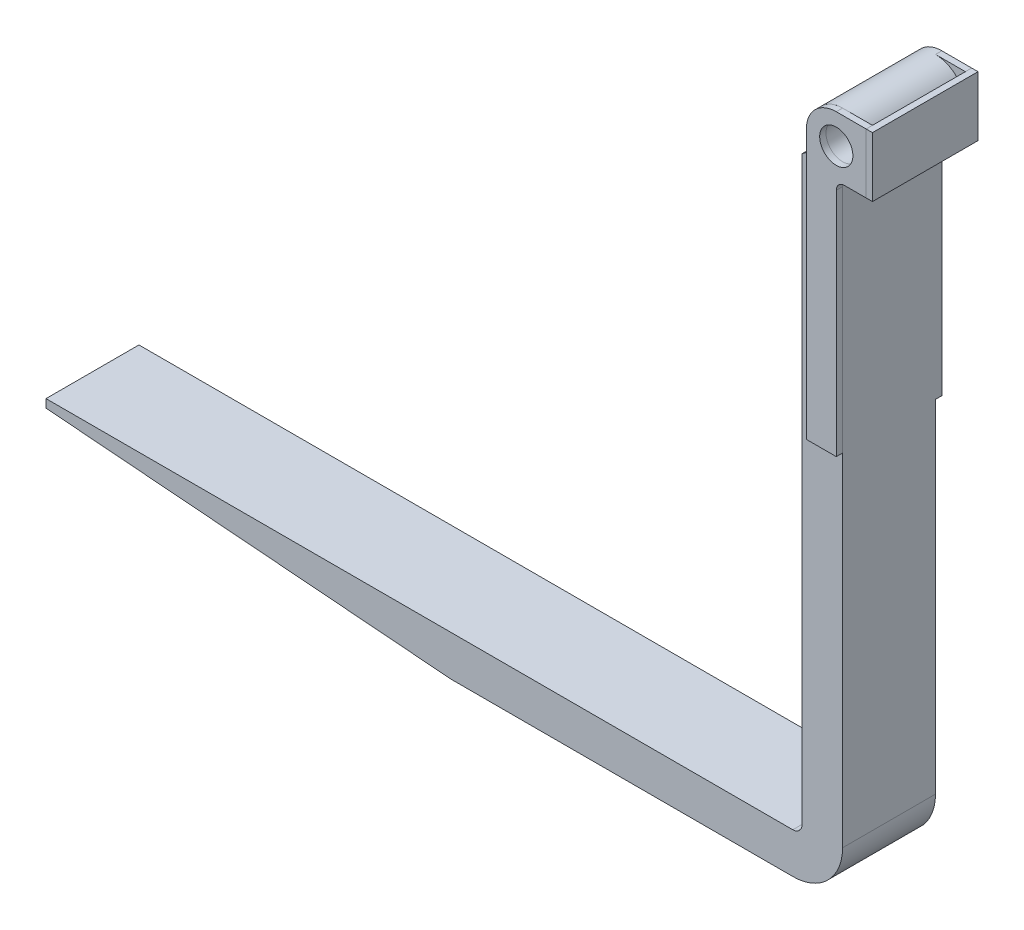
from build123d import *

# Parameters (mm, degrees)
EXTRUDE_THIN1_DEPTH     = 70
CUT_EXTRUDE1_DEPTH      = 1537.912489376
CUT_EXTRUDE1_DEPTH_BACK = 1537.912489376
SKETCH3_R               = 45
SKETCH3_R_2             = 25
BOSS_EXTRUDE1_DEPTH     = 70
BOSS_EXTRUDE2_DEPTH     = 70
SKETCH5_R               = 45
SKETCH5_R_2             = 25
BOSS_EXTRUDE3_DEPTH     = 9.5
SKETCH6_W               = 159
SKETCH6_H               = 90
BOSS_EXTRUDE4_DEPTH     = 9.5


with BuildPart() as part:
    # Sketch1 → Extrude-Thin1 (new, symmetric)
    with BuildSketch(Plane.XY):
        with BuildLine():
            Line((0, 950), (0, 75))
            ThreePointArc((0, 75), (-21.966991411, 21.966991411), (-75, 0))
            Line((-75, 0), (-1200, 0))
            Line((-1200, 0), (-1200, 61))
            Line((-1200, 61), (-75, 61))
            ThreePointArc((-75, 61), (-65.100505063, 65.100505063), (-61, 75))
            Line((-61, 75), (-61, 950))
            Line((-61, 950), (0, 950))
        make_face()
    extrude(amount=EXTRUDE_THIN1_DEPTH, both=True)

    # Sketch2 → Cut-Extrude1 (cut, two sides: drawn at the far end of the back side and taken through both)
    with BuildSketch(Plane.XY.offset(70).offset(-CUT_EXTRUDE1_DEPTH_BACK)):
        Polygon((-4202.326226889, 287.209544269), (-1200, 48.5), (-590, 0), (2412.326226889, -238.709544269), (1934.907138351, -6243.361998046), (-4679.745315427, -5717.442909508), align=None)
    extrude(amount=CUT_EXTRUDE1_DEPTH + CUT_EXTRUDE1_DEPTH_BACK, mode=Mode.SUBTRACT)


with BuildPart() as body_2:
    # Sketch3 → Boss-Extrude1 (new, symmetric)
    with BuildSketch(Plane.XY):
        with Locations((0, 995)):
            Circle(SKETCH3_R)
        with Locations((0, 995)):
            Circle(SKETCH3_R_2, mode=Mode.SUBTRACT)
    extrude(amount=BOSS_EXTRUDE1_DEPTH, both=True)


with BuildPart() as body_3:
    # Sketch4 → Boss-Extrude2 (new, symmetric)
    with BuildSketch(Plane.XY):
        with BuildLine():
            Line((-36.212585863, 968.285797314), (-61, 950))
            Line((-61, 950), (0, 950))
            ThreePointArc((0, 950), (-20.283748164, 954.830738612), (-36.212585863, 968.285797314))
        make_face()
    extrude(amount=BOSS_EXTRUDE2_DEPTH, both=True)


with BuildPart() as body_4:
    # Sketch5 → Boss-Extrude3 (new body)
    # profile 1 of 3: a face of its own
    with BuildSketch(Plane.XY.offset(70)):
        with BuildLine():
            ThreePointArc((45, 995), (0, 950), (-45, 995))
            Line((-45, 995), (-45, 590))
            Line((-45, 590), (0, 590))
            Line((0, 590), (0, 937.5))
            ThreePointArc((0, 937.5), (3.661165235, 946.338834765), (12.5, 950))
            Line((12.5, 950), (45, 950))
            Line((45, 950), (45, 995))
        make_face()
    # profile 2 of 3: a face of its own
    with BuildSketch(Plane.XY.offset(70)):
        with Locations((0, 995)):
            Circle(SKETCH5_R)
        with Locations((0, 995)):
            Circle(SKETCH5_R_2, mode=Mode.SUBTRACT)
    # profile 3 of 3: a face of its own
    with BuildSketch(Plane.XY.offset(70)):
        with BuildLine():
            Line((45, 1040), (0, 1040))
            ThreePointArc((0, 1040), (31.819805153, 1026.819805153), (45, 995))
            Line((45, 995), (45, 1040))
        make_face()
    boss_extrude3 = extrude(amount=BOSS_EXTRUDE3_DEPTH)


with BuildPart() as part_1:
    add(part.part)

    add(body_2.part)  # Mirror1 merges body 2

    add(body_3.part)  # Mirror1 merges body 3
    # Mirror1: Boss-Extrude3 across plane
    add(boss_extrude3.mirror(Plane.XY))


with BuildPart() as body_3_2:
    # Sketch6 → Boss-Extrude4 (new body)
    with BuildSketch(Plane(origin=(45, 0, 0), x_dir=(0, 0, -1), z_dir=(1, 0, 0))):
        with Locations((0, 995)):
            Rectangle(SKETCH6_W, SKETCH6_H)
    extrude(amount=BOSS_EXTRUDE4_DEPTH)


solid = Compound([body_4.part, part_1.part, body_3_2.part])
